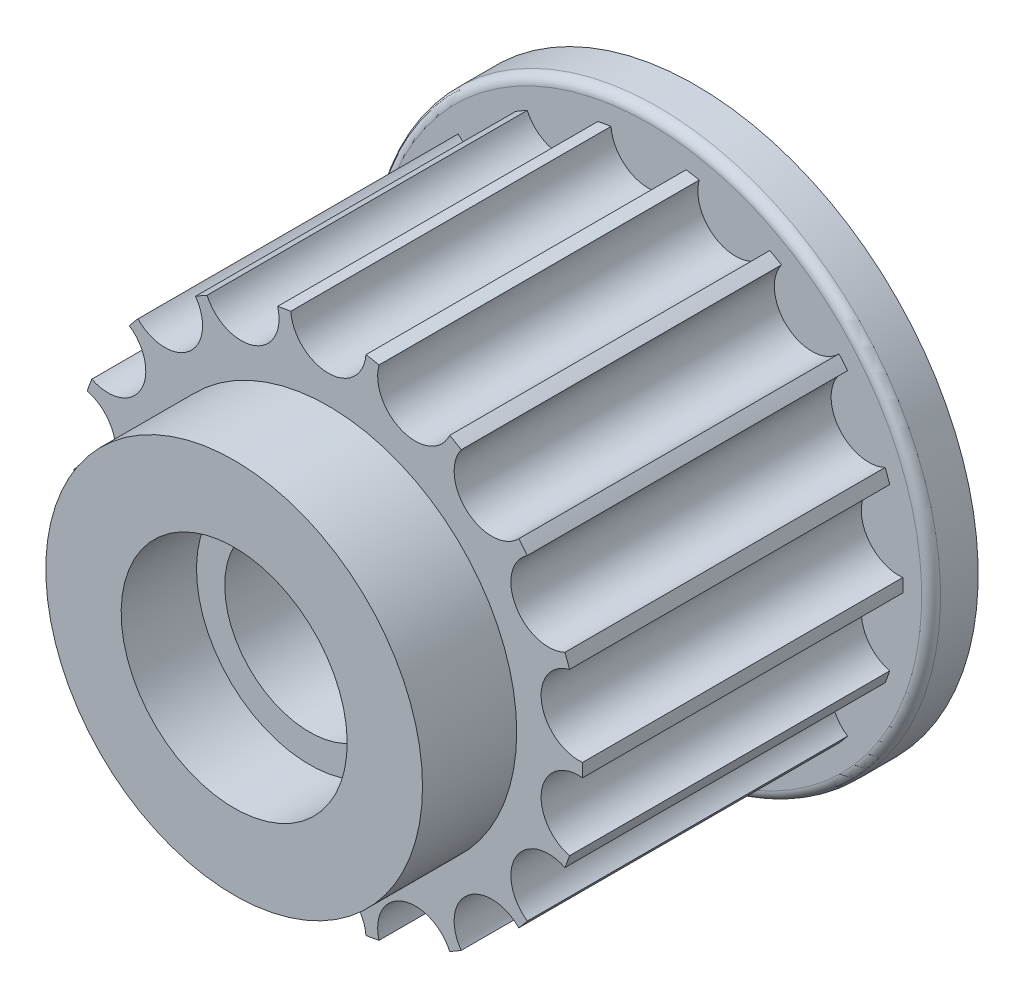
from build123d import *

# Parameters (mm, degrees)
CROQUIS1_R              = 13.5
SALIENTE_EXTRUIR1_DEPTH = 17
CORTAR_EXTRUIR5_START   = -26
CORTAR_EXTRUIR5_DEPTH   = 26
CROQUIS8_R              = 10
SALIENTE_EXTRUIR2_DEPTH = 5
CROQUIS9_R              = 4.5
CORTAR_EXTRUIR6_DEPTH   = 45
CROQUIS10_R             = 6
CORTAR_EXTRUIR8_DEPTH   = 4
CROQUIS12_R             = 15
SALIENTE_EXTRUIR4_DEPTH = 2.5
CORTAR_EXTRUIR9_START   = -25
CROQUIS13_R             = 4.5
CORTAR_EXTRUIR9_DEPTH   = 25
SALIENTE_EXTRUIR5_START = 0.5
CROQUIS14_R             = 10
SALIENTE_EXTRUIR5_DEPTH = 0.5
CORTAR_EXTRUIR10_START  = -2
CROQUIS15_R             = 6
CORTAR_EXTRUIR10_DEPTH  = 2
CORTAR_EXTRUIR12_DEPTH  = 50
REDONDEO1_R             = 0.5


with BuildPart() as part:
    # Croquis1 → Saliente-Extruir1 (new body)
    with BuildSketch(Plane.XY):
        Circle(CROQUIS1_R)
    extrude(amount=SALIENTE_EXTRUIR1_DEPTH)

    # Croquis2 → Cortar-Extruir5 (cut)
    with BuildSketch(Plane.XY.offset(17).offset(CORTAR_EXTRUIR5_START)):
        with BuildLine():
            ThreePointArc((-6.44082437, 11.864475607), (-3.933231648, 10.806465139), (-2.692380198, 13.228797711))
            ThreePointArc((-2.692380198, 13.228797711), (-4.617271935, 12.685850381), (-6.44082437, 11.864475607))
        make_face()
        with BuildLine():
            ThreePointArc((-10.11028478, 8.946068504), (-7.392057511, 8.809511096), (-7.054525094, 11.510155329))
            ThreePointArc((-7.054525094, 11.510155329), (-8.677632731, 10.341599982), (-10.11028478, 8.946068504))
        make_face()
        with BuildLine():
            ThreePointArc((-12.560295633, 4.948633509), (-9.959292144, 5.75), (-10.565790149, 8.403218343))
            ThreePointArc((-10.565790149, 8.403218343), (-11.691342951, 6.75), (-12.560295633, 4.948633509))
        make_face()
        with BuildLine():
            ThreePointArc((1.994505484, 13.351851852), (0, 13.5), (-1.994505484, 13.351851852))
            ThreePointArc((-1.994505484, 13.351851852), (0, 11.5), (1.994505484, 13.351851852))
        make_face()
        with BuildLine():
            ThreePointArc((6.44082437, 11.864475607), (4.617271935, 12.685850381), (2.692380198, 13.228797711))
            ThreePointArc((2.692380198, 13.228797711), (3.933231648, 10.806465139), (6.44082437, 11.864475607))
        make_face()
        with BuildLine():
            ThreePointArc((10.11028478, 8.946068504), (8.677632731, 10.341599982), (7.054525094, 11.510155329))
            ThreePointArc((7.054525094, 11.510155329), (7.392057511, 8.809511096), (10.11028478, 8.946068504))
        make_face()
        with BuildLine():
            ThreePointArc((12.560295633, 4.948633509), (11.691342951, 6.75), (10.565790149, 8.403218343))
            ThreePointArc((10.565790149, 8.403218343), (9.959292144, 5.75), (12.560295633, 4.948633509))
        make_face()
        with BuildLine():
            ThreePointArc((13.495349463, 0.354320278), (13.294904666, 2.344250399), (12.802664978, 4.282729207))
            ThreePointArc((12.802664978, 4.282729207), (11.32528916, 1.996954043), (13.495349463, 0.354320278))
        make_face()
        with BuildLine():
            ThreePointArc((12.802664978, -4.282729207), (13.294904666, -2.344250399), (13.495349463, -0.354320278))
            ThreePointArc((13.495349463, -0.354320278), (11.32528916, -1.996954043), (12.802664978, -4.282729207))
        make_face()
        with BuildLine():
            ThreePointArc((10.565790149, -8.403218343), (11.691342951, -6.75), (12.560295633, -4.948633509))
            ThreePointArc((12.560295633, -4.948633509), (9.959292144, -5.75), (10.565790149, -8.403218343))
        make_face()
        with BuildLine():
            ThreePointArc((7.054525094, -11.510155329), (8.677632731, -10.341599982), (10.11028478, -8.946068504))
            ThreePointArc((10.11028478, -8.946068504), (7.392057511, -8.809511096), (7.054525094, -11.510155329))
        make_face()
        with BuildLine():
            ThreePointArc((2.692380198, -13.228797711), (4.617271935, -12.685850381), (6.44082437, -11.864475607))
            ThreePointArc((6.44082437, -11.864475607), (3.933231648, -10.806465139), (2.692380198, -13.228797711))
        make_face()
        with BuildLine():
            ThreePointArc((1.994505484, -13.351851852), (0, -11.5), (-1.994505484, -13.351851852))
            ThreePointArc((-1.994505484, -13.351851852), (0, -13.5), (1.994505484, -13.351851852))
        make_face()
        with BuildLine():
            ThreePointArc((-2.692380198, -13.228797711), (-3.933231648, -10.806465139), (-6.44082437, -11.864475607))
            ThreePointArc((-6.44082437, -11.864475607), (-4.617271935, -12.685850381), (-2.692380198, -13.228797711))
        make_face()
        with BuildLine():
            ThreePointArc((-7.054525094, -11.510155329), (-7.392057511, -8.809511096), (-10.11028478, -8.946068504))
            ThreePointArc((-10.11028478, -8.946068504), (-8.677632731, -10.341599982), (-7.054525094, -11.510155329))
        make_face()
        with BuildLine():
            ThreePointArc((-10.565790149, -8.403218343), (-9.959292144, -5.75), (-12.560295633, -4.948633509))
            ThreePointArc((-12.560295633, -4.948633509), (-11.691342951, -6.75), (-10.565790149, -8.403218343))
        make_face()
        with BuildLine():
            ThreePointArc((-12.802664978, -4.282729207), (-11.32528916, -1.996954043), (-13.495349463, -0.354320278))
            ThreePointArc((-13.495349463, -0.354320278), (-13.294904666, -2.344250399), (-12.802664978, -4.282729207))
        make_face()
        with BuildLine():
            ThreePointArc((-13.495349463, 0.354320278), (-11.32528916, 1.996954043), (-12.802664978, 4.282729207))
            ThreePointArc((-12.802664978, 4.282729207), (-13.294904666, 2.344250399), (-13.495349463, 0.354320278))
        make_face()
    extrude(amount=CORTAR_EXTRUIR5_DEPTH, mode=Mode.SUBTRACT)

    # Croquis8 → Saliente-Extruir2 (add)
    with BuildSketch(Plane.XY.offset(17)):
        Circle(CROQUIS8_R)
    extrude(amount=SALIENTE_EXTRUIR2_DEPTH)

    # Croquis9 → Cortar-Extruir6 (cut)
    with BuildSketch(Plane.XY.offset(22)):
        Circle(CROQUIS9_R)
    extrude(amount=-CORTAR_EXTRUIR6_DEPTH, mode=Mode.SUBTRACT)

    # Croquis10 → Cortar-Extruir8 (cut)
    with BuildSketch(Plane.XY.offset(22)):
        Circle(CROQUIS10_R)
    extrude(amount=-CORTAR_EXTRUIR8_DEPTH, mode=Mode.SUBTRACT)

    # Croquis12 → Saliente-Extruir4 (add)
    with BuildSketch(Plane(origin=(0, 0, 0), x_dir=(-1, 0, 0), z_dir=(0, 0, -1))):
        Circle(CROQUIS12_R)
    extrude(amount=SALIENTE_EXTRUIR4_DEPTH)

    # Croquis13 → Cortar-Extruir9 (cut)
    with BuildSketch(Plane(origin=(0, 0, -2.5), x_dir=(-1, 0, 0), z_dir=(0, 0, -1)).offset(CORTAR_EXTRUIR9_START)):
        with Locations(Location((0, 0, 0), (0, 0, 180))):
            Circle(CROQUIS13_R)
    extrude(amount=CORTAR_EXTRUIR9_DEPTH, mode=Mode.SUBTRACT)

    # Croquis14 → Saliente-Extruir5 (add)
    with BuildSketch(Plane(origin=(0, 0, -2.5), x_dir=(-1, 0, 0), z_dir=(0, 0, -1)).offset(SALIENTE_EXTRUIR5_START)):
        with Locations(Location((0, 0, 0), (0, 0, 180))):
            Circle(CROQUIS14_R)
    extrude(amount=-SALIENTE_EXTRUIR5_DEPTH)

    # Croquis15 → Cortar-Extruir10 (cut)
    with BuildSketch(Plane(origin=(0, 0, -3), x_dir=(-1, 0, 0), z_dir=(0, 0, -1)).offset(CORTAR_EXTRUIR10_START)):
        with Locations(Location((0, 0, 0), (0, 0, 180))):
            Circle(CROQUIS15_R)
    extrude(amount=CORTAR_EXTRUIR10_DEPTH, mode=Mode.SUBTRACT)

    # Croquis16 → Cortar-Extruir12 (cut)
    with BuildSketch(Plane.XY.offset(22)):
        with BuildLine():
            Line((-1.5, 4.242640687), (-1.5, 5.812640687))
            Line((-1.5, 5.812640687), (1.5, 5.812640687))
            Line((1.5, 5.812640687), (1.5, 4.242640687))
            ThreePointArc((1.5, 4.242640687), (0, 4.5), (-1.5, 4.242640687))
        make_face()
    extrude(amount=-CORTAR_EXTRUIR12_DEPTH, mode=Mode.SUBTRACT)

    # Redondeo1
    redondeo1_edges = [part.edges().sort_by_distance(p)[0] for p in [
        (15, 0, 0),
    ]]
    fillet(redondeo1_edges, radius=REDONDEO1_R)


solid = part.part
